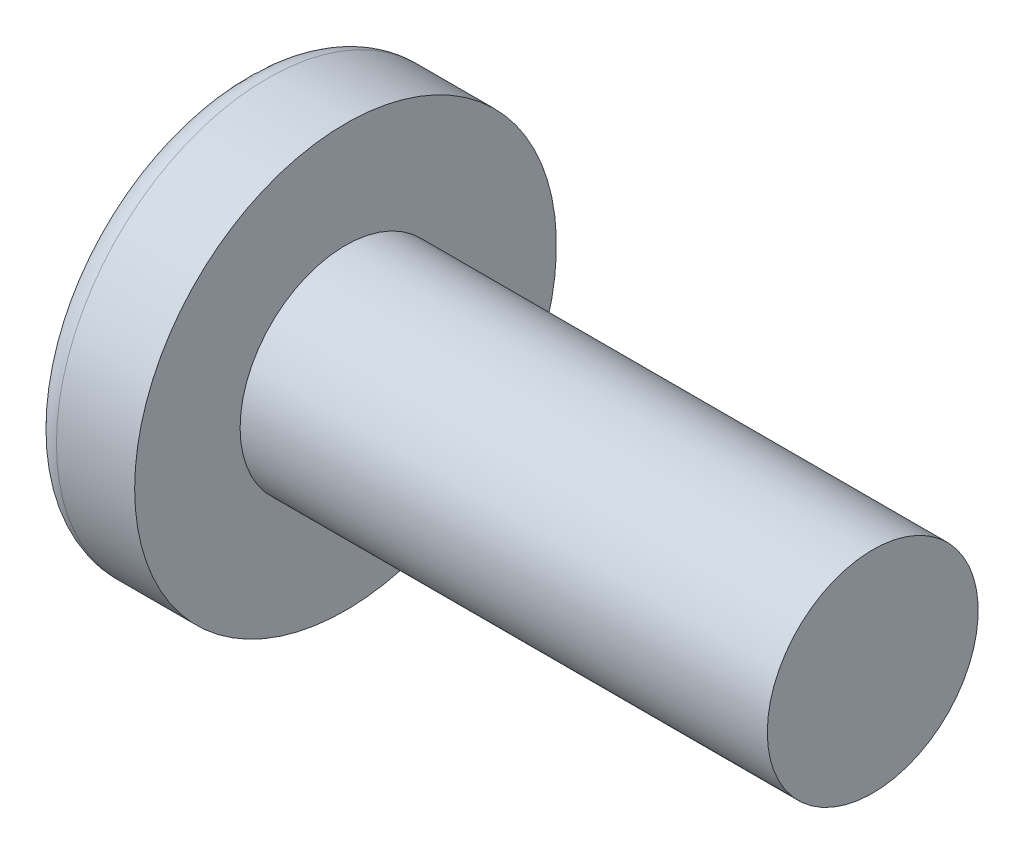
from build123d import *

# Parameters (mm, degrees)
CIRPATTERN1_COUNT = 2
CIRPATTERN1_ANGLE = 90


with BuildPart() as part:
    # BodySke → Base-Revolve (revolve)
    with BuildSketch(Plane.XY, mode=Mode.PRIVATE) as base_revolve_sk:
        with BuildLine():
            Line((3.1, 2), (3.1, 4))
            Line((3.1, 4), (1.616353821, 4))
            ThreePointArc((1.616353821, 4), (1.397629036, 3.947269784), (1.226960106, 3.800664452))
            ThreePointArc((1.226960106, 3.800664452), (0.314340807, 1.996902688), (0, 0))
            Line((0, 0), (13.1, 0))
            Line((13.1, 0), (13.1, 2))
            Line((13.1, 2), (3.1, 2))
        make_face()
    revolve(base_revolve_sk.sketch.rotate(Axis((-25.4, 0, 0), (1, 0, 0)), 90), axis=Axis((-25.4, 0, 0), (1, 0, 0)))

    # Sketch3 → Cut-Loft1 section 0
    with BuildSketch(Plane(origin=(0, 0, 0), x_dir=(0, 0, -1), z_dir=(1, 0, 0))):
        with BuildLine():
            Line((0.465, -2.2), (-0.465, -2.2))
            Line((-0.465, -2.2), (-0.465, 2.2))
            Line((-0.465, 2.2), (0.465, 2.2))
            Line((0.465, 2.2), (0.465, -2.2))
        make_face()
    # Sketch4 → Cut-Loft1 section 1
    with BuildSketch(Plane(origin=(2.45, 0, 0), x_dir=(0, 0, -1), z_dir=(1, 0, 0))):
        with BuildLine():
            Line((0.2325, -0.2325), (-0.2325, -0.2325))
            Line((-0.2325, -0.2325), (-0.2325, 0.2325))
            Line((-0.2325, 0.2325), (0.2325, 0.2325))
            Line((0.2325, 0.2325), (0.2325, -0.2325))
        make_face()
    cut_loft1 = loft(mode=Mode.SUBTRACT)

    # CirPattern1: Cut-Loft1 ×2 about axis
    cirpattern1_axis = Axis((0, 0, 0), (1, 0, 0))
    for i in range(1, CIRPATTERN1_COUNT):
        add(cut_loft1.rotate(cirpattern1_axis, i * CIRPATTERN1_ANGLE / (CIRPATTERN1_COUNT - 1)), mode=Mode.SUBTRACT)


solid = part.part
